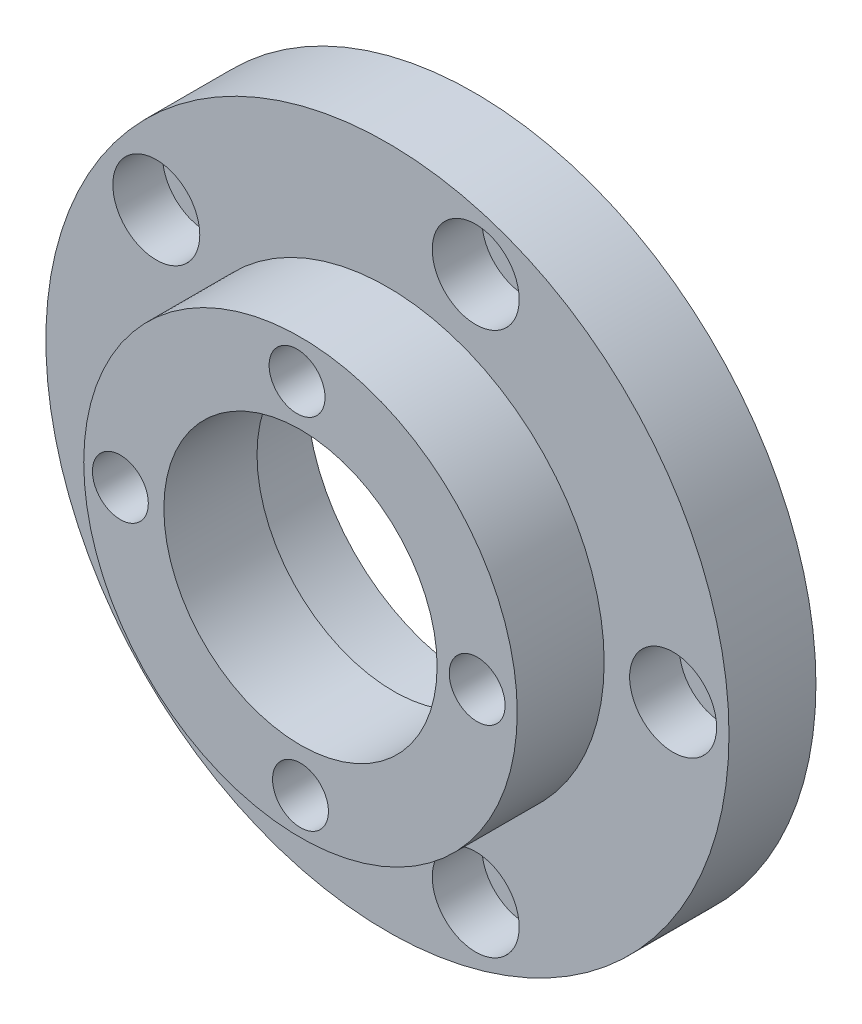
from build123d import *

# Parameters (mm, degrees)
SKETCH1_R              = 27.5
BOTTOMLIP_DEPTH        = 7
SKETCH2_R              = 17.45
SKETCH2_R_2            = 11
UPPERRING_DEPTH        = 7
MIDDLEHOLE_START       = -7
SKETCH4_R              = 11
MIDDLEHOLE_DEPTH       = 7
SKETCH5_R              = 2
STATORHOLES_DEPTH      = 7
SKETCH6_R              = 13.5
INNERBEARINGHOLE_DEPTH = 6.5
SKETCH7_R              = 2.25
MOUNTINGHOLES_DEPTH    = 6
SKETCH8_R              = 3.5
CUT_EXTRUDE1_DEPTH     = 4


with BuildPart() as part:
    # Sketch1 → BottomLip (new body)
    with BuildSketch(Plane.XY):
        Circle(SKETCH1_R)
    extrude(amount=BOTTOMLIP_DEPTH)

    # Sketch2 → UpperRing (add)
    with BuildSketch(Plane.XY.offset(7)):
        Circle(SKETCH2_R)
        Circle(SKETCH2_R_2, mode=Mode.SUBTRACT)
    extrude(amount=UPPERRING_DEPTH)

    # Sketch4 → MiddleHole (cut)
    with BuildSketch(Plane.XY.offset(7).offset(MIDDLEHOLE_START)):
        Circle(SKETCH4_R)
    extrude(amount=MIDDLEHOLE_DEPTH, mode=Mode.SUBTRACT)

    # Sketch5 → StatorHoles (cut)
    with BuildSketch(Plane.XY.offset(7)):
        with Locations((23, 0)):
            Circle(SKETCH5_R)
        with Locations((7.107390871, -21.874299875)):
            Circle(SKETCH5_R)
        with Locations((-18.607390871, -13.519060803)):
            Circle(SKETCH5_R)
        with Locations((-18.607390871, 13.519060803)):
            Circle(SKETCH5_R)
        with Locations((7.107390871, 21.874299875)):
            Circle(SKETCH5_R)
    extrude(amount=-STATORHOLES_DEPTH, mode=Mode.SUBTRACT)

    # Sketch6 → InnerBearingHole (cut)
    with BuildSketch(Plane(origin=(0, 0, 0), x_dir=(-1, 0, 0), z_dir=(0, 0, -1))):
        Circle(SKETCH6_R)
    extrude(amount=-INNERBEARINGHOLE_DEPTH, mode=Mode.SUBTRACT)

    # Sketch7 → MountingHoles (cut)
    with BuildSketch(Plane.XY.offset(14)):
        with Locations((14.225, 0)):
            Circle(SKETCH7_R)
        with Locations((0, -14.5)):
            Circle(SKETCH7_R)
        with Locations((-14.5, -0.275)):
            Circle(SKETCH7_R)
        with Locations((-0.275, 14.225)):
            Circle(SKETCH7_R)
    extrude(amount=-MOUNTINGHOLES_DEPTH, mode=Mode.SUBTRACT)

    # Sketch8 → Cut-Extrude1 (cut)
    with BuildSketch(Plane.XY.offset(7)):
        with Locations((23, 0)):
            Circle(SKETCH8_R)
        with Locations((7.107390871, -21.874299875)):
            Circle(SKETCH8_R)
        with Locations((-18.607390871, -13.519060803)):
            Circle(SKETCH8_R)
        with Locations((-18.607390871, 13.519060803)):
            Circle(SKETCH8_R)
        with Locations((7.107390871, 21.874299875)):
            Circle(SKETCH8_R)
    extrude(amount=-CUT_EXTRUDE1_DEPTH, mode=Mode.SUBTRACT)


solid = part.part
